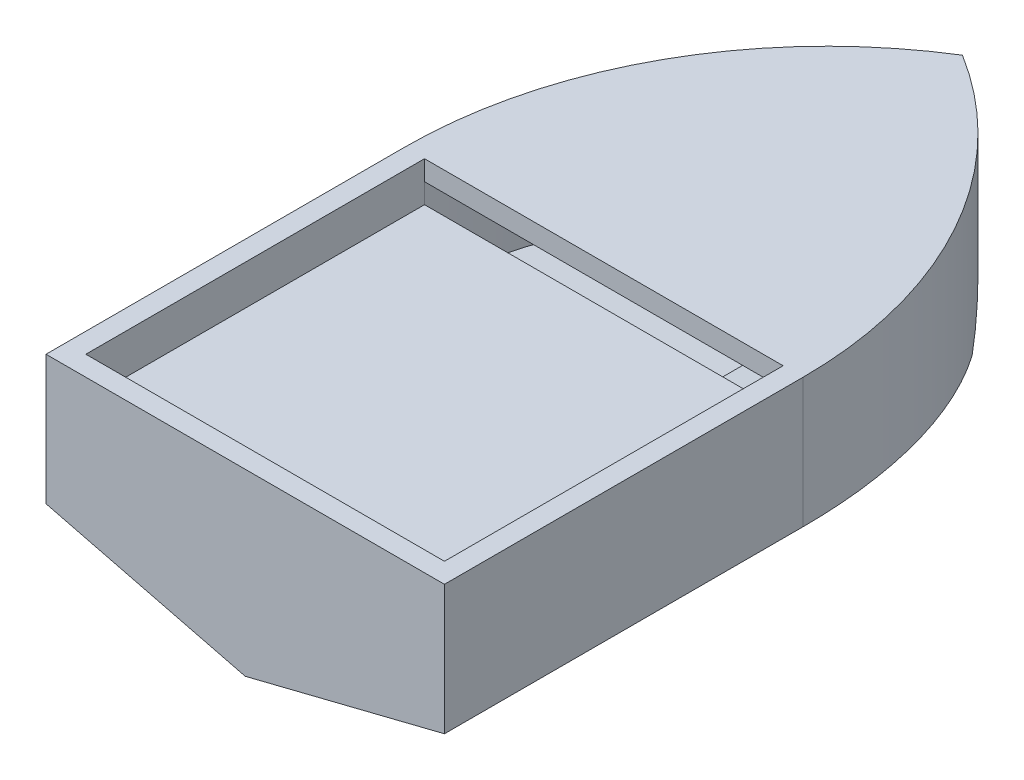
from build123d import *

# Parameters (mm, degrees)
BOSS_EXTRUDE1_DEPTH = 100
CUT_EXTRUDE1_DEPTH  = 385.317577012
CUT_EXTRUDE2_DEPTH  = 385.317577012
SHELL1_T            = -10
SKETCH5_W           = 180
SKETCH5_H           = 170
BOSS_EXTRUDE4_DEPTH = 40
SKETCH5_3_W         = 180
SKETCH5_3_H         = 170
CUT_EXTRUDE4_DEPTH  = 20
BOSS_EXTRUDE5_DEPTH = 10


with BuildPart() as part:
    # Sketch2 → Boss-Extrude1 (new, symmetric)
    with BuildSketch(Plane(origin=(0, 0, 0), x_dir=(0, 0, -1), z_dir=(1, 0, 0))):
        with BuildLine():
            Line((0, 0), (250, 0))
            ThreePointArc((250, 0), (315.192024052, 18.983962204), (360, 70))
            Line((360, 70), (360, 90))
            Line((360, 90), (0, 90))
            Line((0, 90), (0, 0))
        make_face()
    extrude(amount=BOSS_EXTRUDE1_DEPTH, both=True)

    # Sketch3 → Cut-Extrude1 (cut, through all)
    with BuildSketch(Plane.XY):
        Polygon((100, 0), (100, 25), (0, 0), align=None)
        Polygon((0, 0), (-100, 25), (-100, 0), align=None)
    extrude(amount=-CUT_EXTRUDE1_DEPTH, mode=Mode.SUBTRACT)

    # Sketch4 → Cut-Extrude2 (cut, through all)
    with BuildSketch(Plane(origin=(0, 90, 0), x_dir=(1, 0, 0), z_dir=(0, 1, 0))):
        with BuildLine():
            Line((100, 360), (0, 360))
            ThreePointArc((0, 360), (73.321342538, 282.95630141), (100, 180))
            Line((100, 180), (100, 360))
        make_face()
        with BuildLine():
            Line((-100, 360), (-100, 180))
            ThreePointArc((-100, 180), (-73.321342538, 282.95630141), (0, 360))
            Line((0, 360), (-100, 360))
        make_face()
    extrude(amount=-CUT_EXTRUDE2_DEPTH, mode=Mode.SUBTRACT)

    # Shell1
    shell1_openings = [part.faces().sort_by_distance(p)[0] for p in [
        (0, 90, -156.338581153),
    ]]
    offset(amount=SHELL1_T, openings=shell1_openings)

    # Sketch5 → Boss-Extrude4 (add)
    with BuildSketch(Plane(origin=(0, 90, 0), x_dir=(1, 0, 0), z_dir=(0, 1, 0))):
        with Locations((0, 95)):
            Rectangle(SKETCH5_W, SKETCH5_H)
    extrude(amount=-BOSS_EXTRUDE4_DEPTH)

    # Sketch5<3> → Cut-Extrude4 (cut)
    with BuildSketch(Plane(origin=(0, 90, 0), x_dir=(1, 0, 0), z_dir=(0, 1, 0))):
        with Locations((0, 95)):
            Rectangle(SKETCH5_3_W, SKETCH5_3_H)
    extrude(amount=-CUT_EXTRUDE4_DEPTH, mode=Mode.SUBTRACT)

    # Sketch8 → Boss-Extrude5 (add)
    with BuildSketch(Plane(origin=(0, 90, 0), x_dir=(1, 0, 0), z_dir=(0, 1, 0))):
        with BuildLine():
            Line((-90, 180), (90, 180))
            ThreePointArc((90, 180), (66.084249725, 275.341491492), (0, 348.107108713))
            ThreePointArc((0, 348.107108713), (-66.084249725, 275.341491492), (-90, 180))
        make_face()
    extrude(amount=-BOSS_EXTRUDE5_DEPTH)


solid = part.part
